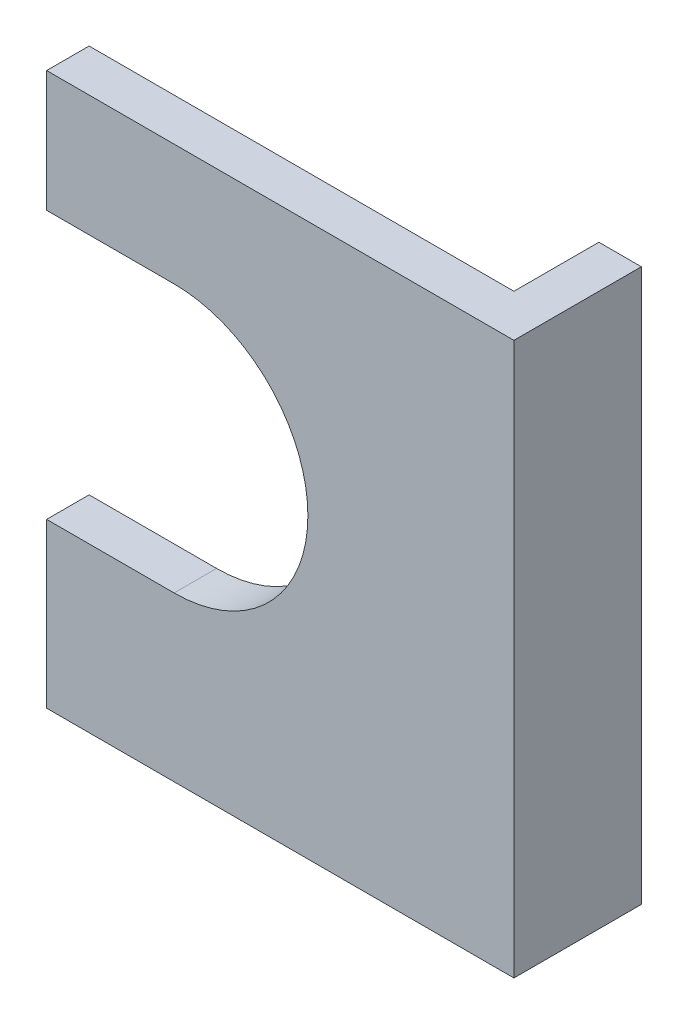
from build123d import *

# Parameters (mm, degrees)
BOSS_EXTRUDE1_DEPTH = 60
SKETCH4_W           = 10
SKETCH4_H           = 90
BOSS_EXTRUDE2_DEPTH = 45
SKETCH6_W           = 25
SKETCH6_H           = 10
BOSS_EXTRUDE3_DEPTH = 45
SKETCH8_W           = 10
SKETCH8_H           = 15
BOSS_EXTRUDE4_DEPTH = 90
BOSS_EXTRUDE5_DEPTH = 30
BOSS_EXTRUDE6_DEPTH = 30
CUT_EXTRUDE1_DEPTH  = 30
CUT_EXTRUDE2_DEPTH  = 25
SKETCH14_W          = 10
SKETCH14_H          = 28.5
CUT_EXTRUDE3_DEPTH  = 25
BOSS_EXTRUDE7_DEPTH = 5


with BuildPart() as part:
    # Sketch1 → Boss-Extrude1 (new body)
    with BuildSketch(Plane(origin=(0, 0, 0), x_dir=(0, 0, -1), z_dir=(1, 0, 0))):
        Polygon((0, -10), (0, 90), (10, 90), (10, 0), (25, 0), (25, -10), align=None)
    extrude(amount=BOSS_EXTRUDE1_DEPTH)

    # Sketch4 → Boss-Extrude2 (add)
    with BuildSketch(Plane(origin=(60, 0, 0), x_dir=(0, 0, -1), z_dir=(1, 0, 0))):
        with Locations((5, 45)):
            Rectangle(SKETCH4_W, SKETCH4_H)
    extrude(amount=BOSS_EXTRUDE2_DEPTH)

    # Sketch6 → Boss-Extrude3 (add)
    with BuildSketch(Plane(origin=(60, 0, 0), x_dir=(0, 0, -1), z_dir=(1, 0, 0))):
        with Locations((12.5, -5)):
            Rectangle(SKETCH6_W, SKETCH6_H)
    extrude(amount=BOSS_EXTRUDE3_DEPTH)

    # Sketch8 → Boss-Extrude4 (add)
    with BuildSketch(Plane(origin=(0, 0, 0), x_dir=(1, 0, 0), z_dir=(0, 1, 0))):
        with Locations((100, 17.5)):
            Rectangle(SKETCH8_W, SKETCH8_H)
    extrude(amount=BOSS_EXTRUDE4_DEPTH)

    # Sketch10 → Boss-Extrude5 (add)
    with BuildSketch(Plane.ZY):
        Polygon((0, -10), (0, 90), (-10, 90), (-10, 0), (-25, 0), (-25, -10), align=None)
    extrude(amount=BOSS_EXTRUDE5_DEPTH)

    # Sketch11 → Boss-Extrude6 (add)
    with BuildSketch(Plane(origin=(0, 90, 0), x_dir=(1, 0, 0), z_dir=(0, 1, 0))):
        Polygon((-30, 10), (-30, 0), (105, 0), (105, 25), (95, 25), (95, 10), align=None)
    extrude(amount=BOSS_EXTRUDE6_DEPTH)

    # Sketch12 → Cut-Extrude1 (cut)
    with BuildSketch(Plane(origin=(0, 0, -10), x_dir=(-1, 0, 0), z_dir=(0, 0, -1))):
        with BuildLine():
            Line((-25, 91.5), (30, 91.5))
            Line((30, 91.5), (30, 28.5))
            Line((30, 28.5), (-25, 28.5))
            ThreePointArc((-25, 28.5), (-56.5, 60), (-25, 91.5))
        make_face()
    extrude(amount=-CUT_EXTRUDE1_DEPTH, mode=Mode.SUBTRACT)

    # Sketch13 → Cut-Extrude2 (cut)
    with BuildSketch(Plane.ZY.offset(30)):
        Polygon((0, 28.5), (-10, 28.5), (-10, 0), (-25, 0), (-25, -10), (0, -10), align=None)
    extrude(amount=-CUT_EXTRUDE2_DEPTH, mode=Mode.SUBTRACT)

    # Sketch14 → Cut-Extrude3 (cut)
    with BuildSketch(Plane.ZY.offset(30)):
        with Locations((-5, 105.75)):
            Rectangle(SKETCH14_W, SKETCH14_H)
    extrude(amount=-CUT_EXTRUDE3_DEPTH, mode=Mode.SUBTRACT)

    # Sketch15 → Boss-Extrude7 (add)
    with BuildSketch(Plane(origin=(0, 0, -25), x_dir=(-1, 0, 0), z_dir=(0, 0, -1))):
        Polygon((5, -10), (5, 0), (-95, 0), (-95, 120), (-105, 120), (-105, -10), align=None)
    extrude(amount=BOSS_EXTRUDE7_DEPTH)


solid = part.part
